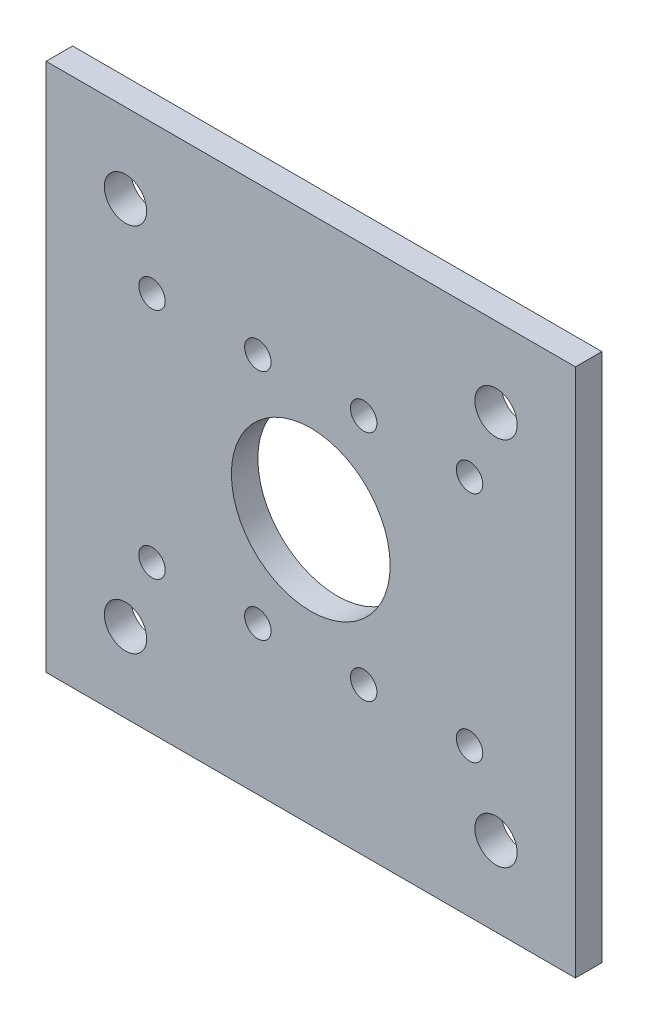
from build123d import *

# Parameters (mm, degrees)
SKETCH1_W           = 100
SKETCH1_H           = 100
SKETCH1_R           = 4
SKETCH1_R_2         = 15
BOSS_EXTRUDE1_DEPTH = 5
SKETCH2_R           = 2.5
CUT_EXTRUDE1_DEPTH  = 10


with BuildPart() as part:
    # Sketch1 → Boss-Extrude1 (new body)
    with BuildSketch(Plane.XY):
        with Locations((50, 50)):
            Rectangle(SKETCH1_W, SKETCH1_H)
        with Locations((15, 85)):
            Circle(SKETCH1_R, mode=Mode.SUBTRACT)
        with Locations((85, 85)):
            Circle(SKETCH1_R, mode=Mode.SUBTRACT)
        with Locations((85, 15)):
            Circle(SKETCH1_R, mode=Mode.SUBTRACT)
        with Locations((15, 15)):
            Circle(SKETCH1_R, mode=Mode.SUBTRACT)
        with Locations((50, 50)):
            Circle(SKETCH1_R_2, mode=Mode.SUBTRACT)
    extrude(amount=BOSS_EXTRUDE1_DEPTH)

    # Sketch2 → Cut-Extrude1 (cut)
    with BuildSketch(Plane.XY.offset(5)):
        with Locations((20, 72)):
            Circle(SKETCH2_R)
        with Locations((40, 72)):
            Circle(SKETCH2_R)
        with Locations((60, 72)):
            Circle(SKETCH2_R)
        with Locations((80, 72)):
            Circle(SKETCH2_R)
        with Locations((80, 28)):
            Circle(SKETCH2_R)
        with Locations((60, 28)):
            Circle(SKETCH2_R)
        with Locations((40, 28)):
            Circle(SKETCH2_R)
        with Locations((20, 28)):
            Circle(SKETCH2_R)
    extrude(amount=-CUT_EXTRUDE1_DEPTH, mode=Mode.SUBTRACT)


solid = part.part
